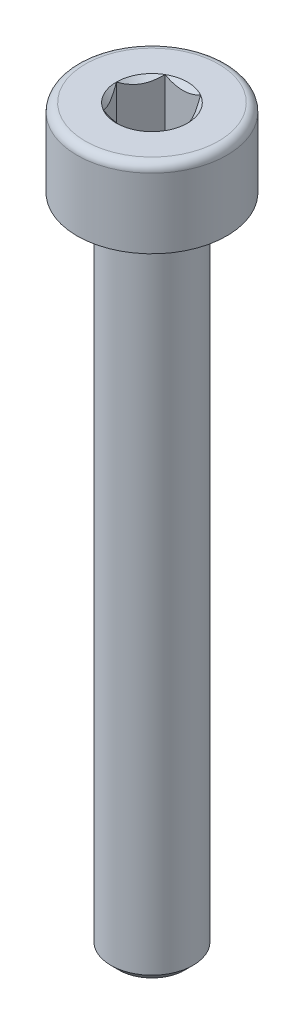
from build123d import *

# Parameters (mm, degrees)
CUT_EXTRUDE1_DEPTH  = 1.1
BOSS_EXTRUDE1_REACH = 20.585
BOSS_EXTRUDE1_START = -0.5
SKETCH2_3_R         = 1.309481769


with BuildPart() as part:
    # Sketch1 → Revolve1 (revolve)
    with BuildSketch(Plane(origin=(0, 0, 0), x_dir=(0, 0, -1), z_dir=(1, 0, 0))):
        with BuildLine():
            Line((0, -16), (0.8, -16))
            Line((0.8, -16), (1, -15.8))
            Line((1, -15.8), (1, -0.2))
            ThreePointArc((1, -0.2), (1.058578644, -0.058578644), (1.2, 0))
            Line((1.2, 0), (1.825, 0))
            Line((1.825, 0), (1.825, 1.7))
            ThreePointArc((1.825, 1.7), (1.766421356, 1.841421356), (1.625, 1.9))
            Line((1.625, 1.9), (0.8675, 1.9))
            Line((0.8675, 1.9), (0.75, 1.7825))
            Line((0.75, 1.7825), (0.75, 0.9))
            Line((0.75, 0.9), (0.8675, 0.9))
            Line((0.8675, 0.9), (0.8675, 0.7))
            Line((0.8675, 0.7), (0, 0.199148641))
            Line((0, 0.199148641), (0, -16))
        make_face()
    revolve(axis=Axis((0, 2.837665271, 0), (0, -1, 0)))

    # Sketch2 → Cut-Extrude1 (cut)
    with BuildSketch(Plane(origin=(0, 1.9, 0), x_dir=(1, 0, 0), z_dir=(0, 1, 0))):
        Polygon((-0.433012702, -0.75), (0.433012702, -0.75), (0.866025404, 0), (0.433012702, 0.75), (-0.433012702, 0.75), (-0.866025404, 0), align=None)
    extrude(amount=-CUT_EXTRUDE1_DEPTH, mode=Mode.SUBTRACT)

    # Boss-Extrude1: up to this cone (the profile starts inside it)
    boss_extrude1_end = Plane(origin=(0, 1.4, 0), z_dir=(0, 1, 0)).offset(-1.200850359) * Cone(1.732e-06, 42.202780918, 24.365785924, align=(Align.CENTER, Align.CENTER, Align.MIN), mode=Mode.PRIVATE)
    # Sketch2<3> → Boss-Extrude1 (add, up to the surface)
    with BuildSketch(Plane(origin=(0, 1.9, 0), x_dir=(1, 0, 0), z_dir=(0, 1, 0)).offset(BOSS_EXTRUDE1_START), mode=Mode.PRIVATE) as boss_extrude1_sk1:
        Circle(SKETCH2_3_R)
        Polygon((0.433012702, -0.75), (0.866025404, 0), (0.433012702, 0.75), (-0.433012702, 0.75), (-0.866025404, 0), (-0.433012702, -0.75), align=None, mode=Mode.SUBTRACT)
    boss_extrude1_tool1 = extrude(boss_extrude1_sk1.sketch, amount=-BOSS_EXTRUDE1_REACH, mode=Mode.PRIVATE) & boss_extrude1_end
    add(boss_extrude1_tool1.solids().sort_by_distance((-1.272444, 1.4, 0))[0])


solid = part.part
